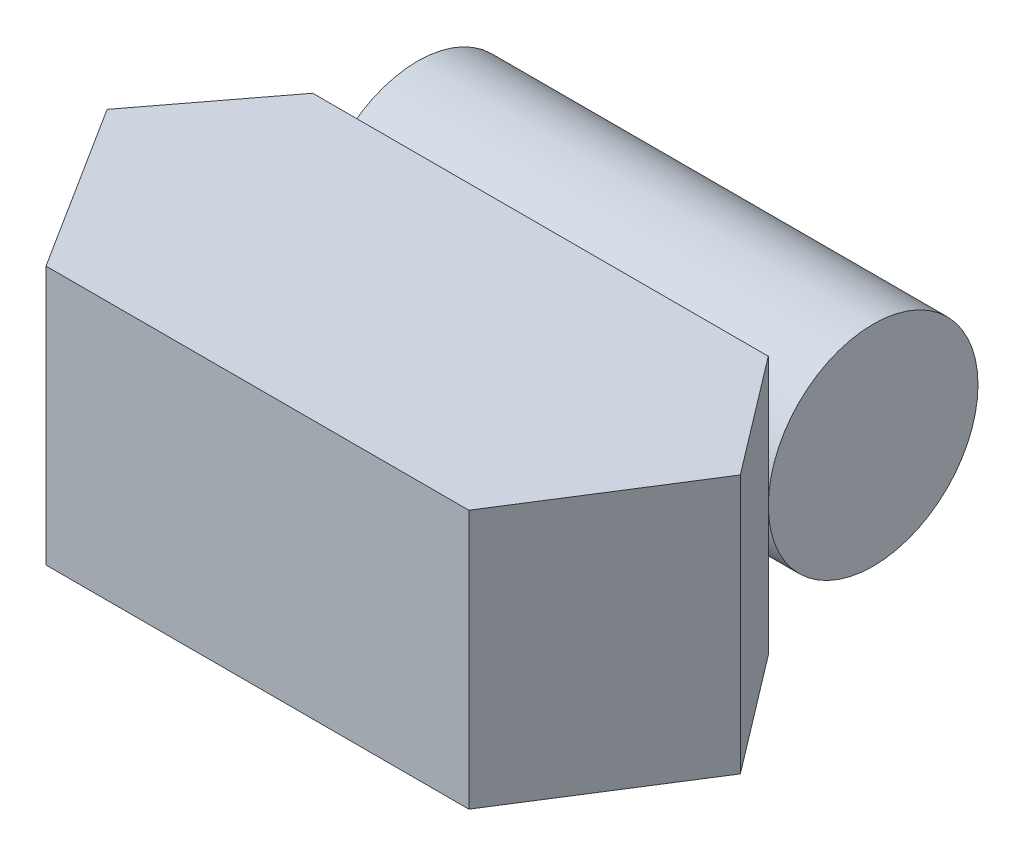
from build123d import *

# Parameters (mm, degrees)
BOSS_EXTRUDE1_DEPTH      = 15
BOSS_EXTRUDE2_DEPTH      = 13.19777
BOSS_EXTRUDE2_DEPTH_BACK = 13.19777
SKETCH2_R                = 6.075


with BuildPart() as part:
    # Sketch1 → Boss-Extrude1 (new body)
    with BuildSketch(Plane(origin=(0, 0, 0), x_dir=(1, 0, 0), z_dir=(0, 1, 0))):
        Polygon((-13.197769506, 0), (-18.343682878, -6.765321542), (-12.25, -16.4), (12.25, -16.4), (18.343682878, -6.765321542), (13.197769506, 0), align=None)
    extrude(amount=BOSS_EXTRUDE1_DEPTH)


with BuildPart() as body_2:
    # Sketch2 → Boss-Extrude2 (new, two sides: drawn at the far end of the back side and taken through both)
    with BuildSketch(Plane(origin=(0, 0, 0), x_dir=(0, 0, -1), z_dir=(1, 0, 0)).offset(-BOSS_EXTRUDE2_DEPTH_BACK)):
        with Locations((6.075, 7.5)):
            Circle(SKETCH2_R)
    extrude(amount=BOSS_EXTRUDE2_DEPTH + BOSS_EXTRUDE2_DEPTH_BACK)


solid = Compound([part.part, body_2.part])
